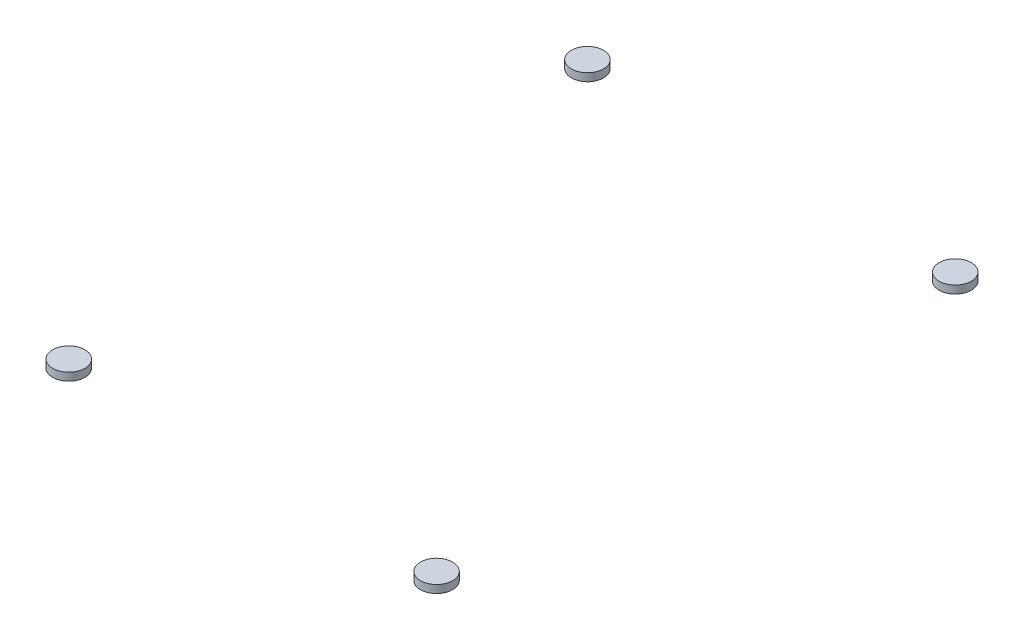
from build123d import *

# Parameters (mm, degrees)
SKETCH1_R           = 2.05
BOSS_EXTRUDE1_DEPTH = 1
SKETCH2_R           = 2.05
BOSS_EXTRUDE2_DEPTH = 1
SKETCH3_R           = 2.05
BOSS_EXTRUDE3_DEPTH = 1
SKETCH4_R           = 2.05
BOSS_EXTRUDE4_DEPTH = 1


with BuildPart() as part:
    # Sketch1 → Boss-Extrude1 (new body)
    with BuildSketch(Plane(origin=(0, 0, 0), x_dir=(1, 0, 0), z_dir=(0, 1, 0))):
        with Locations(Location((-23.4, 48, 0), (0, 0, 270))):
            Circle(SKETCH1_R)
    extrude(amount=BOSS_EXTRUDE1_DEPTH)


with BuildPart() as body_2:
    # Sketch2 → Boss-Extrude2 (new body)
    with BuildSketch(Plane(origin=(0, 0, 0), x_dir=(1, 0, 0), z_dir=(0, 1, 0))):
        with Locations(Location((-23.4, -18, 0), (0, 0, 270))):
            Circle(SKETCH2_R)
    extrude(amount=BOSS_EXTRUDE2_DEPTH)


with BuildPart() as body_3:
    # Sketch3 → Boss-Extrude3 (new body)
    with BuildSketch(Plane(origin=(0, 0, 0), x_dir=(1, 0, 0), z_dir=(0, 1, 0))):
        with Locations(Location((23.4, 48, 0), (0, 0, 270))):
            Circle(SKETCH3_R)
    extrude(amount=BOSS_EXTRUDE3_DEPTH)


with BuildPart() as body_4:
    # Sketch4 → Boss-Extrude4 (new body)
    with BuildSketch(Plane(origin=(0, 0, 0), x_dir=(1, 0, 0), z_dir=(0, 1, 0))):
        with Locations(Location((23.4, -18, 0), (0, 0, 270))):
            Circle(SKETCH4_R)
    extrude(amount=BOSS_EXTRUDE4_DEPTH)


solid = Compound([part.part, body_2.part, body_3.part, body_4.part])
